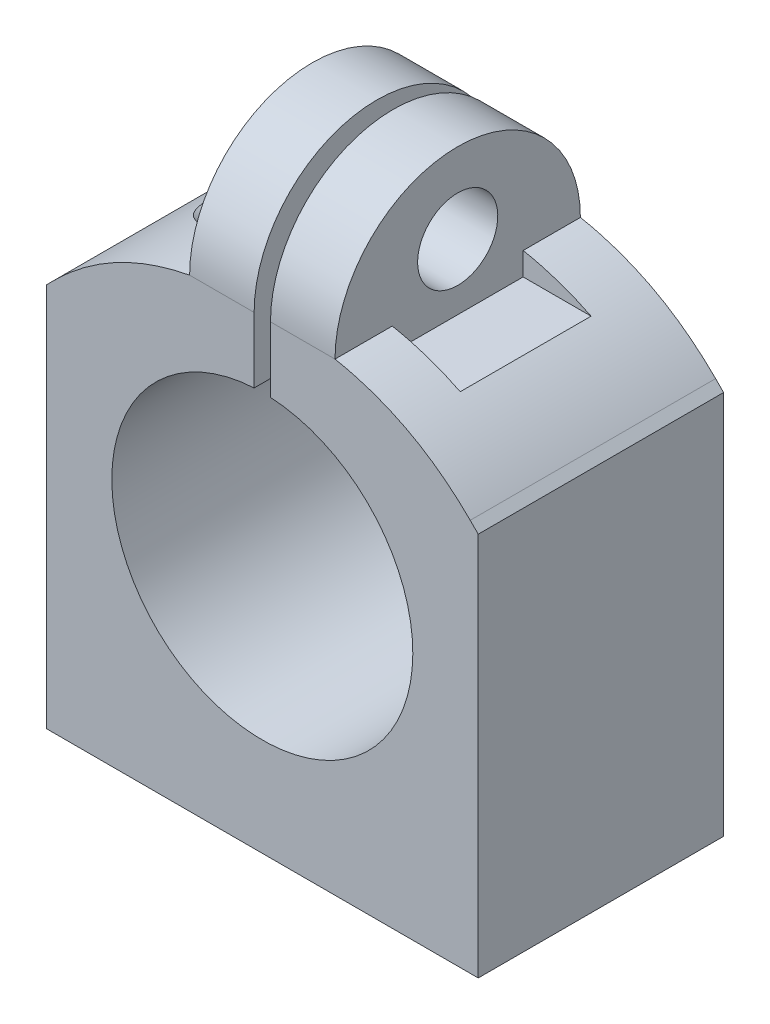
from build123d import *

# Parameters (mm, degrees)
BOSS_EXTRUDE1_DEPTH = 19.05
SKETCH2_R           = 3.1115
BOSS_EXTRUDE3_DEPTH = 5.00888
CUT_EXTRUDE1_DEPTH  = 37.525855062
SKETCH3_R           = 6.35
CUT_EXTRUDE2_DEPTH  = 40.436271203
SKETCH5_W           = 10.16
SKETCH5_H           = 10.16
CUT_EXTRUDE3_DEPTH  = 40.436271203


with BuildPart() as part:
    # Sketch1 → Boss-Extrude1 (new body)
    with BuildSketch(Plane.XY):
        with BuildLine():
            Line((-16.764, 10.535978608), (-13.649989304, 13.649989304))
            ThreePointArc((-13.649989304, 13.649989304), (-11.72846788, 15.33256199), (-9.60163475, 16.746731805))
            Line((-9.60163475, 16.746731805), (-0.635, 16.746731805))
            Line((-0.635, 16.746731805), (-0.635, 11.666731805))
            ThreePointArc((-0.635, 11.666731805), (0, -11.684), (0.635, 11.666731805))
            Line((0.635, 11.666731805), (0.635, 16.746731805))
            Line((0.635, 16.746731805), (9.60163475, 16.746731805))
            ThreePointArc((9.60163475, 16.746731805), (11.72846788, 15.33256199), (13.649989304, 13.649989304))
            Line((13.649989304, 13.649989304), (16.764, 10.535978608))
            Line((16.764, 10.535978608), (16.764, -19.304))
            Line((16.764, -19.304), (-16.764, -19.304))
            Line((-16.764, -19.304), (-16.764, 10.535978608))
        make_face()
    extrude(amount=BOSS_EXTRUDE1_DEPTH)

    # Sketch2 → Boss-Extrude3 (add)
    with BuildSketch(Plane.ZY.offset(-0.635)):
        with BuildLine():
            Line((19.05, 16.746731805), (0, 16.746731805))
            ThreePointArc((0, 16.746731805), (9.525, 26.271731805), (19.05, 16.746731805))
        make_face()
        with Locations(Location((9.525, 20.048731805, 0), (0, 0, 270))):
            Circle(SKETCH2_R, mode=Mode.SUBTRACT)
    boss_extrude3 = extrude(amount=-BOSS_EXTRUDE3_DEPTH)

    # Mirror7: Boss-Extrude3 across plane
    add(boss_extrude3.mirror(Plane(origin=(0, 0, 0), x_dir=(0, 0, 1), z_dir=(1, 0, 0))))

    # Sketch4 → Cut-Extrude1 (cut, through all)
    with BuildSketch(Plane(origin=(0, 0, 0), x_dir=(-1, 0, 0), z_dir=(0, 0, -1))):
        with BuildLine():
            Line((-16.141246803, 11.158731805), (-16.141246803, 17.710333674))
            Line((-16.141246803, 17.710333674), (-5.64388, 16.746731805))
            add(Edge.make_bspline(
                [(-5.64388, 16.746731805), (-11.711664831, 15.588313777), (-16.141246803, 11.158731805)],
                knots=[0, 0, 0, 1, 1, 1], degree=2))
        make_face()
        with BuildLine():
            Line((16.141246803, 17.710333674), (5.64388, 16.746731805))
            add(Edge.make_bspline(
                [(5.64388, 16.746731805), (11.711664831, 15.588313777), (16.141246803, 11.158731805)],
                knots=[0, 0, 0, 1, 1, 1], degree=2))
            Line((16.141246803, 11.158731805), (16.141246803, 17.710333674))
        make_face()
    extrude(amount=-CUT_EXTRUDE1_DEPTH, mode=Mode.SUBTRACT)

    # Sketch3 → Cut-Extrude2 (cut, through all)
    with BuildSketch(Plane.ZY.offset(5.64388)):
        with Locations((9.525, 20.048731805)):
            Circle(SKETCH3_R)
    extrude(amount=CUT_EXTRUDE2_DEPTH, mode=Mode.SUBTRACT)

    # Sketch5 → Cut-Extrude3 (cut, through all)
    with BuildSketch(Plane(origin=(5.64388, 0, 0), x_dir=(0, 0, -1), z_dir=(1, 0, 0))):
        with Locations((-9.525, 20.048731805)):
            Rectangle(SKETCH5_W, SKETCH5_H)
    extrude(amount=CUT_EXTRUDE3_DEPTH, mode=Mode.SUBTRACT)


solid = part.part
